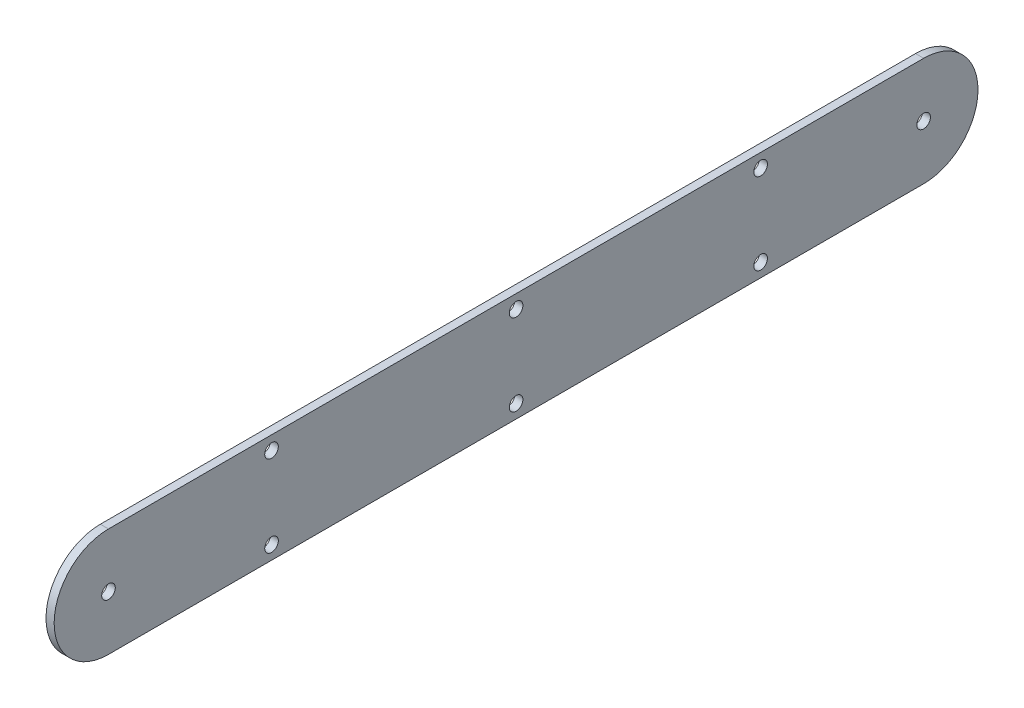
from build123d import *

# Parameters (mm, degrees)
SKETCH1_R           = 2.5
BOSS_EXTRUDE1_DEPTH = 3


with BuildPart() as part:
    # Sketch1 → Boss-Extrude1 (new body)
    with BuildSketch(Plane(origin=(0, 0, 0), x_dir=(0, 0, -1), z_dir=(1, 0, 0))):
        with BuildLine():
            Line((-150, -20), (150, -20))
            ThreePointArc((150, -20), (170, 0), (150, 20))
            Line((150, 20), (-150, 20))
            ThreePointArc((-150, 20), (-170, 0), (-150, -20))
        make_face()
        with Locations((150, 0)):
            Circle(SKETCH1_R, mode=Mode.SUBTRACT)
        with Locations((-150, 0)):
            Circle(SKETCH1_R, mode=Mode.SUBTRACT)
        with Locations((90, 15)):
            Circle(SKETCH1_R, mode=Mode.SUBTRACT)
        with Locations((90, -15)):
            Circle(SKETCH1_R, mode=Mode.SUBTRACT)
        with Locations((-90, 15)):
            Circle(SKETCH1_R, mode=Mode.SUBTRACT)
        with Locations((-90, -15)):
            Circle(SKETCH1_R, mode=Mode.SUBTRACT)
        with Locations((0, 15)):
            Circle(SKETCH1_R, mode=Mode.SUBTRACT)
        with Locations((0, -15)):
            Circle(SKETCH1_R, mode=Mode.SUBTRACT)
    extrude(amount=BOSS_EXTRUDE1_DEPTH)


solid = part.part
